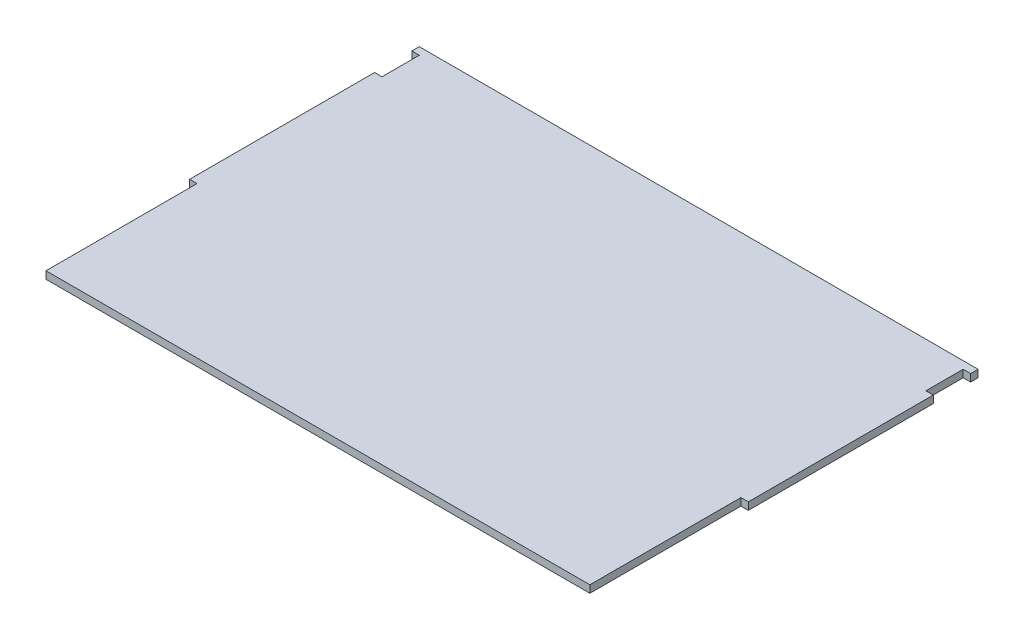
from build123d import *

# Parameters (mm, degrees)
BOSS_EXTRUDE1_DEPTH = 3
SKETCH3_W           = 3
SKETCH3_H           = 74.822620372
BOSS_EXTRUDE2_DEPTH = 3


with BuildPart() as part:
    # Sketch1 → Boss-Extrude1 (new body)
    with BuildSketch(Plane(origin=(0, 0, 0), x_dir=(1, 0, 0), z_dir=(0, 1, 0))):
        Polygon((0, 154), (-3, 154), (-3, 151), (0, 151), (0, 0), (220, 0), (220, 151), (223, 151), (223, 154), (220, 154), align=None)
    extrude(amount=BOSS_EXTRUDE1_DEPTH)

    # Sketch3 → Boss-Extrude2 (add)
    with BuildSketch(Plane(origin=(0, 3, 0), x_dir=(1, 0, 0), z_dir=(0, 1, 0))):
        with Locations((-1.5, 98.49947017)):
            Rectangle(SKETCH3_W, SKETCH3_H)
        with Locations((221.5, 98.49947017)):
            Rectangle(SKETCH3_W, SKETCH3_H)
    extrude(amount=-BOSS_EXTRUDE2_DEPTH)


solid = part.part
